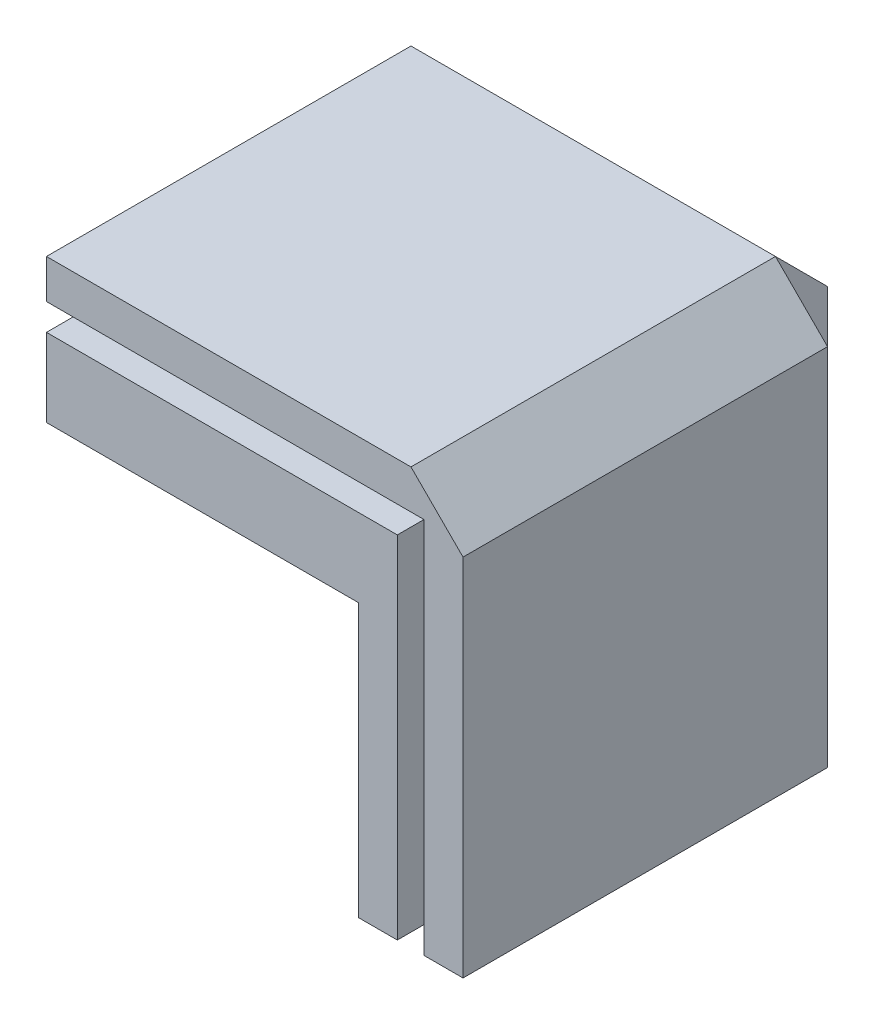
from build123d import *

# Parameters (mm, degrees)
SKETCH4_W               = 50.8
SKETCH4_H               = 50.8
BOSS_EXTRUDE4_DEPTH     = 50.8
SKETCH5_W               = 38.0238
SKETCH5_H               = 38.0238
CUT_EXTRUDE1_DEPTH      = 38.0238
CUT_EXTRUDE2_DEPTH      = 31.6738
CUT_EXTRUDE3_DEPTH      = 88.988181024
CUT_EXTRUDE3_DEPTH_BACK = 31.6738
CUT_EXTRUDE4_DEPTH      = 31.6738
CHAMFER1_SIZE           = 6.35
SKETCH9_W               = 38.0238
SKETCH9_H               = 4.7625
BOSS_EXTRUDE5_DEPTH     = 38.0238
SKETCH10_W              = 25.781
SKETCH10_H              = 3.2258
CUT_EXTRUDE5_DEPTH      = 31.6738


with BuildPart() as part:
    # Sketch4 → Boss-Extrude4 (new body)
    with BuildSketch(Plane(origin=(0, 0, 0), x_dir=(1, 0, 0), z_dir=(0, 1, 0))):
        with Locations((25.4, 25.4)):
            Rectangle(SKETCH4_W, SKETCH4_H)
    extrude(amount=BOSS_EXTRUDE4_DEPTH)

    # Sketch5 → Cut-Extrude1 (cut)
    with BuildSketch(Plane.XZ):
        with Locations((19.0119, -19.0119)):
            Rectangle(SKETCH5_W, SKETCH5_H)
    extrude(amount=-CUT_EXTRUDE1_DEPTH, mode=Mode.SUBTRACT)

    # Sketch6 → Cut-Extrude2 (cut)
    with BuildSketch(Plane.ZY):
        Polygon((-46.0375, 0), (-42.7863, 0), (-42.7863, 42.7863), (0, 42.7863), (0, 46.0375), (-46.0375, 46.0375), align=None)
    extrude(amount=-CUT_EXTRUDE2_DEPTH, mode=Mode.SUBTRACT)

    # Sketch7 → Cut-Extrude3 (cut, two sides: drawn at the far end of the back side and taken through both)
    with BuildSketch(Plane.XY.offset(-CUT_EXTRUDE3_DEPTH_BACK)):
        Polygon((46.0375, 46.0375), (31.6738, 46.0375), (31.6738, 42.7863), (42.7863, 42.7863), (42.7863, 0), (46.0375, 0), align=None)
    extrude(amount=CUT_EXTRUDE3_DEPTH + CUT_EXTRUDE3_DEPTH_BACK, mode=Mode.SUBTRACT)

    # Sketch8 → Cut-Extrude4 (cut)
    with BuildSketch(Plane.XZ):
        Polygon((31.6738, -46.0375), (46.0375, -46.0375), (46.0375, -31.6738), (42.7863, -31.6738), (42.7863, -42.7863), (31.6738, -42.7863), align=None)
    extrude(amount=-CUT_EXTRUDE4_DEPTH, mode=Mode.SUBTRACT)

    # Chamfer1
    chamfer1_edges = [part.edges().sort_by_distance(p)[0] for p in [
        (50.8, 50.8, -25.4),
        (25.4, 50.8, -50.8),
        (50.8, 25.4, -50.8),
    ]]
    chamfer(chamfer1_edges, length=CHAMFER1_SIZE)

    # Sketch9 → Boss-Extrude5 (add)
    with BuildSketch(Plane.ZY.offset(-38.0238)):
        with Locations((-19.0119, 35.64255)):
            Rectangle(SKETCH9_W, SKETCH9_H)
    extrude(amount=BOSS_EXTRUDE5_DEPTH)

    # Sketch10 → Cut-Extrude5 (cut)
    with BuildSketch(Plane.ZY):
        with Locations((-29.8958, 41.1734)):
            Rectangle(SKETCH10_W, SKETCH10_H)
    extrude(amount=-CUT_EXTRUDE5_DEPTH, mode=Mode.SUBTRACT)


solid = part.part
